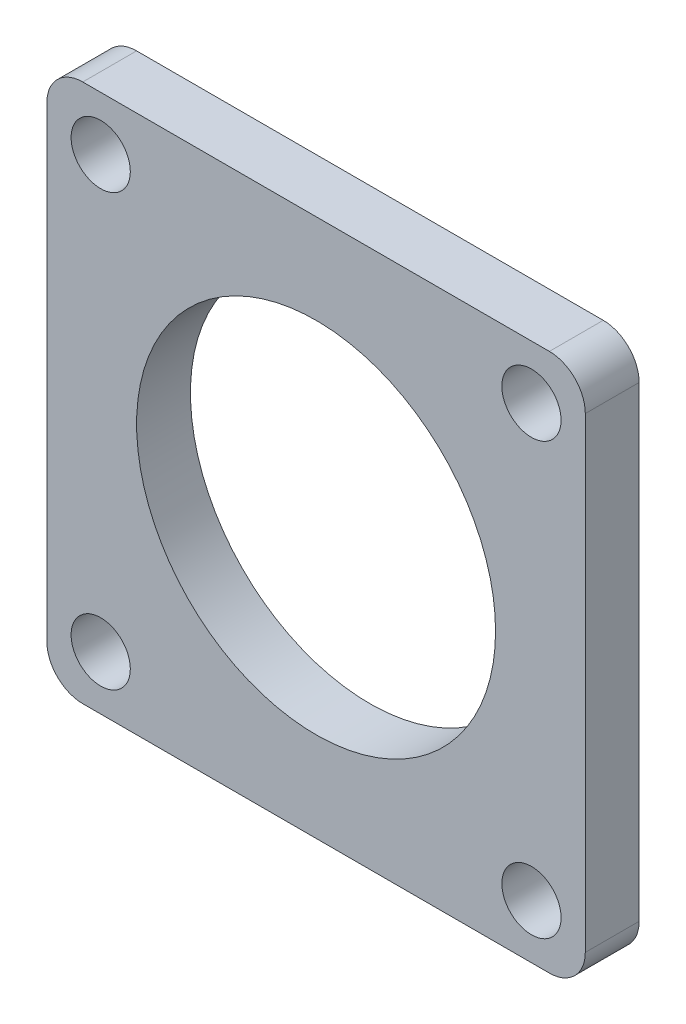
from build123d import *

# Parameters (mm, degrees)
SKETCH_1_W      = 30
SKETCH_1_H      = 30
SKETCH_1_R      = 10
SKETCH_1_R_2    = 1.65
EXTRUDE_1_DEPTH = 3
FILLET_1_R      = 2


with BuildPart() as part:
    # 草图1 → 凸台-拉伸1 (new body)
    with BuildSketch(Plane.XY):
        Rectangle(SKETCH_1_W, SKETCH_1_H)
        Circle(SKETCH_1_R, mode=Mode.SUBTRACT)
        with Locations((-12, 12)):
            Circle(SKETCH_1_R_2, mode=Mode.SUBTRACT)
        with Locations((-12, -12)):
            Circle(SKETCH_1_R_2, mode=Mode.SUBTRACT)
        with Locations((12, 12)):
            Circle(SKETCH_1_R_2, mode=Mode.SUBTRACT)
        with Locations((12, -12)):
            Circle(SKETCH_1_R_2, mode=Mode.SUBTRACT)
    extrude(amount=EXTRUDE_1_DEPTH)

    # 圆角1
    fillet_1_edges = [part.edges().sort_by_distance(p)[0] for p in [
        (-15, -15, 1.5),
        (-15, 15, 1.5),
        (15, 15, 1.5),
        (15, -15, 1.5),
    ]]
    fillet(fillet_1_edges, radius=FILLET_1_R)


solid = part.part
